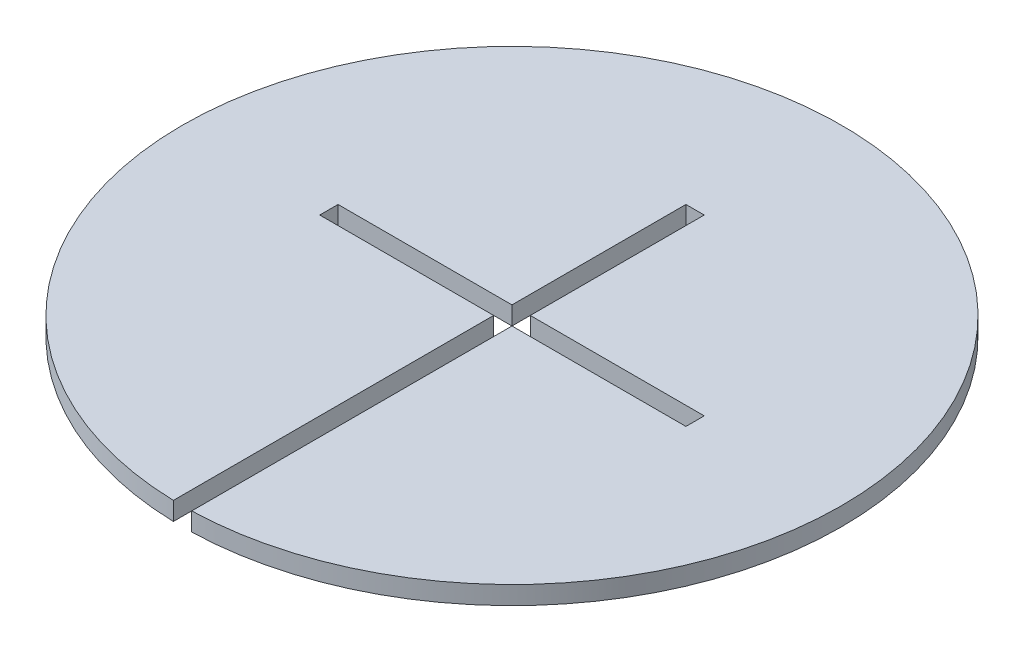
from build123d import *

# Parameters (mm, degrees)
SKETCH1_R           = 114.3
BOSS_EXTRUDE1_DEPTH = 6.35
SKETCH2_W           = 6.35
SKETCH2_H           = 114.3
CUT_EXTRUDE1_DEPTH  = 6.35
SKETCH3_W           = 127
SKETCH3_H           = 6.35
CUT_EXTRUDE2_DEPTH  = 162.769287876
SKETCH4_W           = 6.35
SKETCH4_H           = 63.5
CUT_EXTRUDE3_DEPTH  = 162.769287876


with BuildPart() as part:
    # Sketch1 → Boss-Extrude1 (new body)
    with BuildSketch(Plane(origin=(0, 0, 0), x_dir=(1, 0, 0), z_dir=(0, 1, 0))):
        with Locations(Location((0, 0, 0), (0, 0, 270))):
            Circle(SKETCH1_R)
    extrude(amount=BOSS_EXTRUDE1_DEPTH)

    # Sketch2 → Cut-Extrude1 (cut)
    with BuildSketch(Plane(origin=(0, 6.35, 0), x_dir=(1, 0, 0), z_dir=(0, 1, 0))):
        with Locations((0, -57.15)):
            Rectangle(SKETCH2_W, SKETCH2_H)
    extrude(amount=-CUT_EXTRUDE1_DEPTH, mode=Mode.SUBTRACT)

    # Sketch3 → Cut-Extrude2 (cut, through all)
    with BuildSketch(Plane(origin=(0, 6.35, 0), x_dir=(1, 0, 0), z_dir=(0, 1, 0))):
        Rectangle(SKETCH3_W, SKETCH3_H)
    extrude(amount=-CUT_EXTRUDE2_DEPTH, mode=Mode.SUBTRACT)

    # Sketch4 → Cut-Extrude3 (cut, through all)
    with BuildSketch(Plane(origin=(0, 6.35, 0), x_dir=(1, 0, 0), z_dir=(0, 1, 0))):
        with Locations((0, 31.75)):
            Rectangle(SKETCH4_W, SKETCH4_H)
    extrude(amount=-CUT_EXTRUDE3_DEPTH, mode=Mode.SUBTRACT)


solid = part.part
